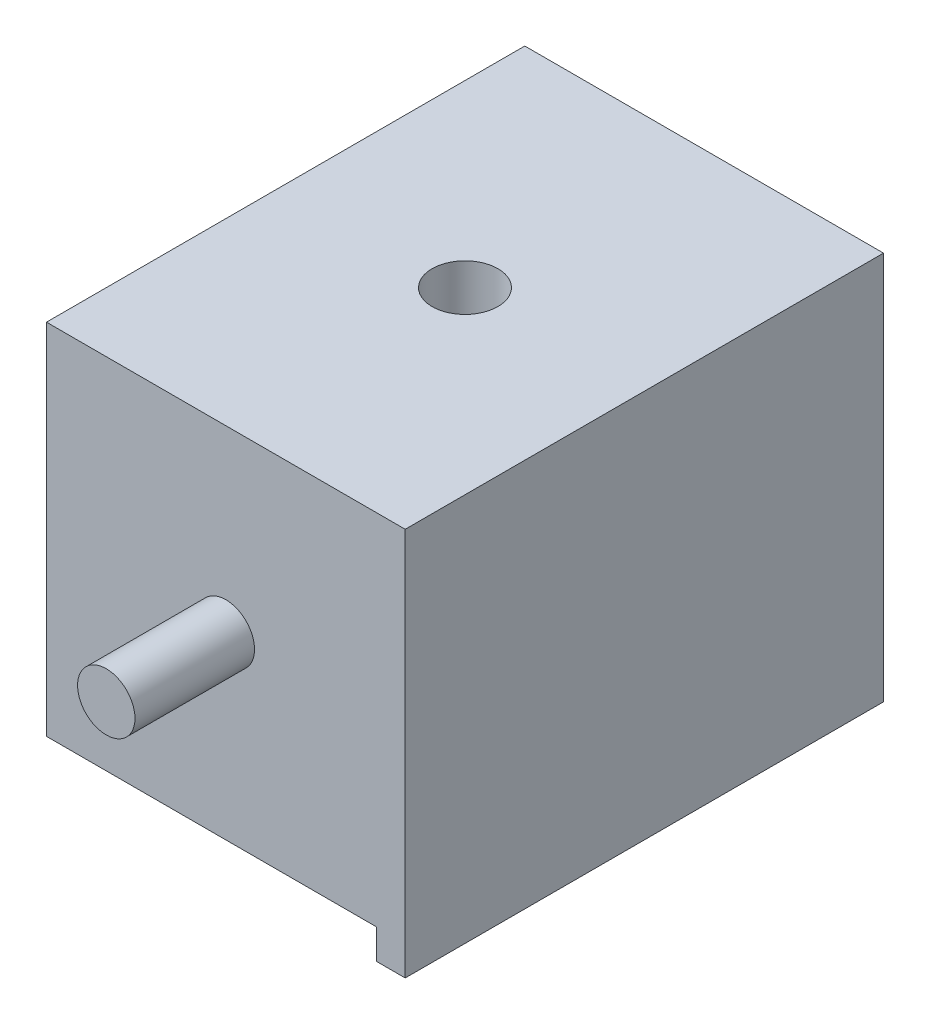
from build123d import *

# Parameters (mm, degrees)
SKETCH1_W           = 38.1
SKETCH1_H           = 38.1
BOSS_EXTRUDE1_DEPTH = 25.4
SKETCH2_R           = 3.048
BOSS_EXTRUDE2_DEPTH = 12.7
SKETCH3_W           = 3.048
SKETCH3_H           = 50.8
BOSS_EXTRUDE3_DEPTH = 3.175
SKETCH4_R           = 3.4925
CUT_EXTRUDE1_DEPTH  = 58.15


with BuildPart() as part:
    # Sketch1 → Boss-Extrude1 (new, symmetric)
    with BuildSketch(Plane.XY):
        Rectangle(SKETCH1_W, SKETCH1_H)
    extrude(amount=BOSS_EXTRUDE1_DEPTH, both=True)

    # Sketch2 → Boss-Extrude2 (add)
    with BuildSketch(Plane.XY.offset(25.4)):
        with Locations(Location((0, 0, 0), (0, 0, 180))):
            Circle(SKETCH2_R)
    extrude(amount=BOSS_EXTRUDE2_DEPTH)

    # Sketch3 → Boss-Extrude3 (add)
    with BuildSketch(Plane.XZ.offset(19.05)):
        with Locations((17.526, 0)):
            Rectangle(SKETCH3_W, SKETCH3_H)
    extrude(amount=BOSS_EXTRUDE3_DEPTH)

    # Sketch4 → Cut-Extrude1 (cut, through all)
    with BuildSketch(Plane.XZ.offset(19.05)):
        with Locations(Location((0, 0, 0), (0, 0, 270))):
            Circle(SKETCH4_R)
    extrude(amount=-CUT_EXTRUDE1_DEPTH, mode=Mode.SUBTRACT)


solid = part.part
